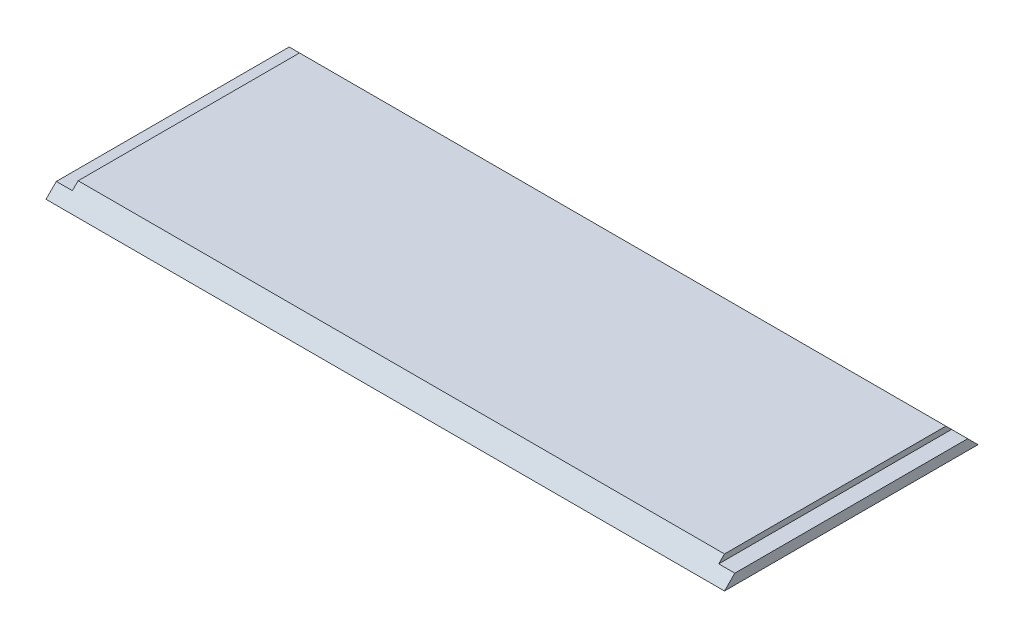
from build123d import *

# Parameters (mm, degrees)
SKETCH_1_W          = 118.3
SKETCH_1_H          = 44.2
EXTRUDE_1_DEPTH     = 2.8
SKETCH_2_W          = 2.8
SKETCH_2_H          = 44.2
CUT_EXTRUDE_1_DEPTH = 1
CUT_EXTRUDE_2_DEPTH = 122.622082534


with BuildPart() as part:
    # 草图1 → 凸台-拉伸1 (new body)
    with BuildSketch(Plane(origin=(0, 0, 0), x_dir=(1, 0, 0), z_dir=(0, 1, 0))):
        with Locations((13.975775656, 5.992720764)):
            Rectangle(SKETCH_1_W, SKETCH_1_H)
    extrude(amount=EXTRUDE_1_DEPTH)

    # 草图2 → 切除-拉伸1 (cut)
    with BuildSketch(Plane(origin=(0, 2.8, 0), x_dir=(1, 0, 0), z_dir=(0, 1, 0))):
        with Locations((-43.774224344, 5.992720764)):
            Rectangle(SKETCH_2_W, SKETCH_2_H)
        with Locations((71.725775656, 5.992720764)):
            Rectangle(SKETCH_2_W, SKETCH_2_H)
    extrude(amount=-CUT_EXTRUDE_1_DEPTH, mode=Mode.SUBTRACT)

    # 草图3 → 切除-拉伸2 (cut, through all)
    with BuildSketch(Plane.ZY.offset(45.174224344)):
        Polygon((-28.092720764, 0), (-28.092720764, 2.8), (-25.292720764, 2.8), align=None)
        Polygon((16.107279236, 0), (16.107279236, 2.8), (13.307279236, 2.8), align=None)
    extrude(amount=-CUT_EXTRUDE_2_DEPTH, mode=Mode.SUBTRACT)


solid = part.part
